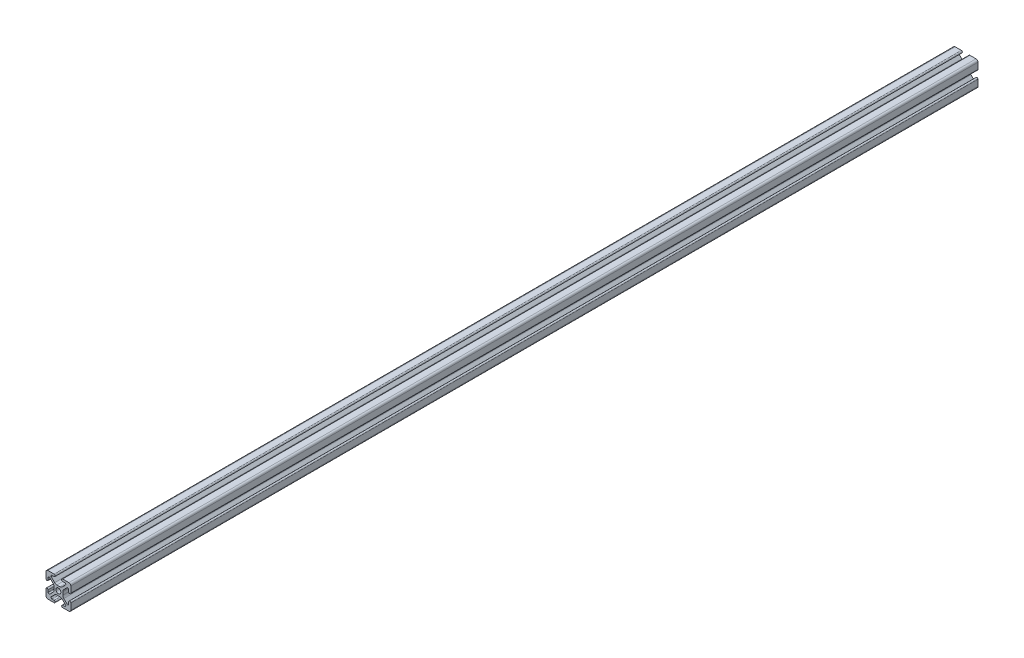
from build123d import *

# Parameters (mm, degrees)
SKETCH1_R      = 2.5
EXTRUDE1_DEPTH = 914.4


with BuildPart() as part:
    # Sketch1 → Extrude1 (new body)
    with BuildSketch(Plane.XY):
        with BuildLine():
            Line((-8.636346088, 7.111588351), (-5.432204773, 3.912143135))
            ThreePointArc((-5.432204773, 3.912143135), (-4.708985779, 2.831057106), (-4.455, 1.555406707))
            Line((-4.455, 1.555406707), (-4.455, -1.555406707))
            ThreePointArc((-4.455, -1.555406707), (-4.708985779, -2.831057106), (-5.432204773, -3.912143135))
            Line((-5.432204773, -3.912143135), (-8.636346088, -7.111588351))
            ThreePointArc((-8.636346088, -7.111588351), (-9.736852394, -7.329863489), (-10.36, -6.396886949))
            Line((-10.36, -6.396886949), (-10.36, -4.32))
            ThreePointArc((-10.36, -4.32), (-11.43, -3.25), (-12.5, -4.32))
            Line((-12.5, -4.32), (-12.5, -8.651801989))
            Line((-12.5, -8.651801989), (-12.5, -10.537068835))
            ThreePointArc((-12.5, -10.537068835), (-11.925070773, -11.925070773), (-10.537068835, -12.5))
            Line((-10.537068835, -12.5), (-8.441567612, -12.5))
            Line((-8.441567612, -12.5), (-4.387856959, -12.5))
            ThreePointArc((-4.387856959, -12.5), (-3.317856959, -11.43), (-4.387856959, -10.36))
            Line((-4.387856959, -10.36), (-6.42, -10.36))
            ThreePointArc((-6.42, -10.36), (-7.35325999, -9.736168088), (-7.133653912, -8.635298598))
            Line((-7.133653912, -8.635298598), (-3.795290766, -5.301828272))
            ThreePointArc((-3.795290766, -5.301828272), (-2.76743922, -4.61585726), (-1.555406707, -4.375))
            Line((-1.555406707, -4.375), (1.555406707, -4.375))
            ThreePointArc((1.555406707, -4.375), (2.76743922, -4.61585726), (3.795290766, -5.301828272))
            Line((3.795290766, -5.301828272), (7.133653912, -8.635298598))
            ThreePointArc((7.133653912, -8.635298598), (7.35325999, -9.736168088), (6.42, -10.36))
            Line((6.42, -10.36), (4.387856959, -10.36))
            ThreePointArc((4.387856959, -10.36), (3.317856959, -11.43), (4.387856959, -12.5))
            Line((4.387856959, -12.5), (8.441567612, -12.5))
            Line((8.441567612, -12.5), (10.537068835, -12.5))
            ThreePointArc((10.537068835, -12.5), (11.925070773, -11.925070773), (12.5, -10.537068835))
            Line((12.5, -10.537068835), (12.5, -8.651801989))
            Line((12.5, -8.651801989), (12.5, -4.32))
            ThreePointArc((12.5, -4.32), (11.43, -3.25), (10.36, -4.32))
            Line((10.36, -4.32), (10.36, -6.396886949))
            ThreePointArc((10.36, -6.396886949), (9.736852394, -7.329863489), (8.636346088, -7.111588351))
            Line((8.636346088, -7.111588351), (5.432204773, -3.912143135))
            ThreePointArc((5.432204773, -3.912143135), (4.708985779, -2.831057106), (4.455, -1.555406707))
            Line((4.455, -1.555406707), (4.455, 1.555406707))
            ThreePointArc((4.455, 1.555406707), (4.708985779, 2.831057106), (5.432204773, 3.912143135))
            Line((5.432204773, 3.912143135), (8.636346088, 7.111588351))
            ThreePointArc((8.636346088, 7.111588351), (9.736852394, 7.329863489), (10.36, 6.396886949))
            Line((10.36, 6.396886949), (10.36, 4.32))
            ThreePointArc((10.36, 4.32), (11.43, 3.25), (12.5, 4.32))
            Line((12.5, 4.32), (12.5, 7.99129648))
            Line((12.5, 7.99129648), (12.5, 10.537068835))
            ThreePointArc((12.5, 10.537068835), (11.925070773, 11.925070773), (10.537068835, 12.5))
            Line((10.537068835, 12.5), (4.32, 12.5))
            ThreePointArc((4.32, 12.5), (3.25, 11.43), (4.32, 10.36))
            Line((4.32, 10.36), (6.42, 10.36))
            ThreePointArc((6.42, 10.36), (7.35325999, 9.736168088), (7.133653912, 8.635298598))
            Line((7.133653912, 8.635298598), (3.795290766, 5.301828272))
            ThreePointArc((3.795290766, 5.301828272), (2.76743922, 4.61585726), (1.555406707, 4.375))
            Line((1.555406707, 4.375), (-1.555406707, 4.375))
            ThreePointArc((-1.555406707, 4.375), (-2.76743922, 4.61585726), (-3.795290766, 5.301828272))
            Line((-3.795290766, 5.301828272), (-7.133653912, 8.635298598))
            ThreePointArc((-7.133653912, 8.635298598), (-7.35325999, 9.736168088), (-6.42, 10.36))
            Line((-6.42, 10.36), (-4.32, 10.36))
            ThreePointArc((-4.32, 10.36), (-3.25, 11.43), (-4.32, 12.5))
            Line((-4.32, 12.5), (-10.537068835, 12.5))
            ThreePointArc((-10.537068835, 12.5), (-11.925070773, 11.925070773), (-12.5, 10.537068835))
            Line((-12.5, 10.537068835), (-12.5, 7.99129648))
            Line((-12.5, 7.99129648), (-12.5, 4.32))
            ThreePointArc((-12.5, 4.32), (-11.43, 3.25), (-10.36, 4.32))
            Line((-10.36, 4.32), (-10.36, 6.396886949))
            ThreePointArc((-10.36, 6.396886949), (-9.736852394, 7.329863489), (-8.636346088, 7.111588351))
        make_face()
        Circle(SKETCH1_R, mode=Mode.SUBTRACT)
    extrude(amount=-EXTRUDE1_DEPTH)


solid = part.part
